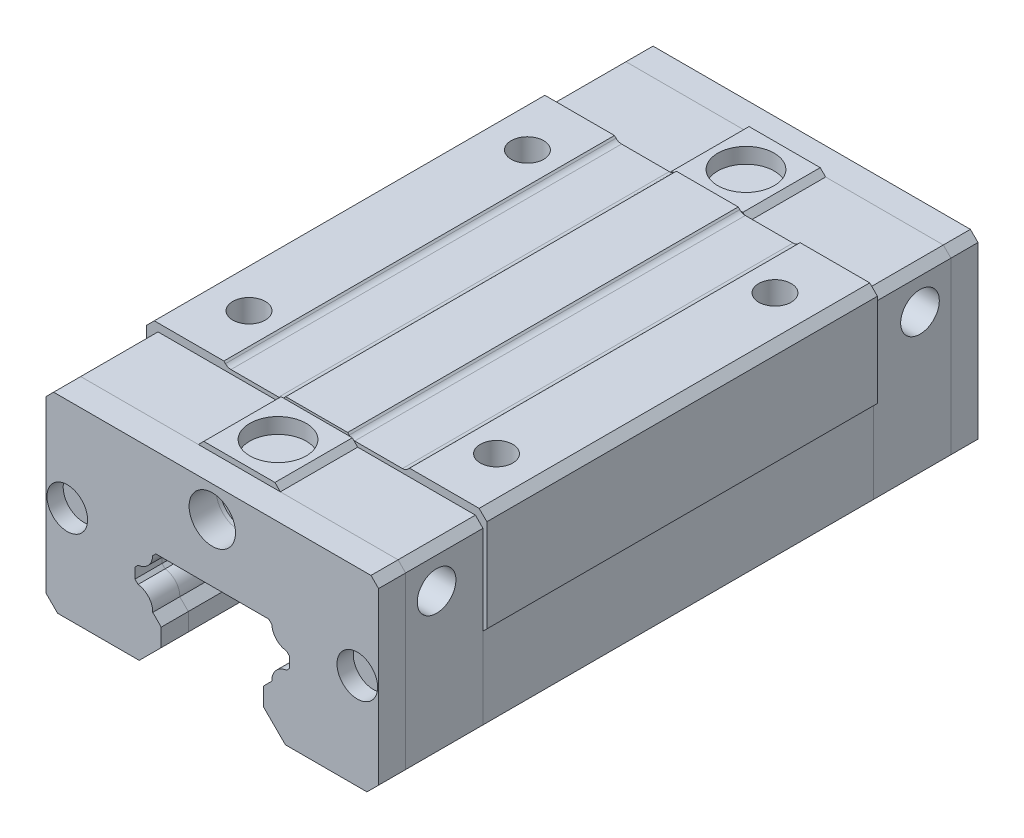
from build123d import *

# Parameters (mm, degrees)
BASE_DEPTH                     = 25.25
GREEN_BODY_DEPTH               = 10
SKETCH5_R                      = 3.65
TOP_HOLE_GB_DEPTH              = 2
SKETCH6_R                      = 2.5
SIDE_HOLE_GB_DEPTH             = 6.7
GREEN_BODY_VM_DEPTH            = 10
GB_FEATURES_VM_COPY_1_SKETCH_R = 2.5
GB_FEATURES_VM_COPY_1_DEPTH    = 6.7
RED_BODY_DEPTH                 = 3.5
SKETCH9_R                      = 2.625
RB_HOLE_DEPTH                  = 2.1
SKETCH10_R                     = 3
CUT_EXTRUDE1_DEPTH             = 4


with BuildPart() as part:
    # Sketch1 → BASE (new, symmetric)
    with BuildSketch(Plane.XY):
        with BuildLine():
            Line((-7.3, 3.5), (7.3, 3.5))
            Line((7.3, 3.5), (7.7, 3.1))
            ThreePointArc((7.7, 3.1), (8.274662952, 1.735331905), (9.6, 1.075))
            Line((9.6, 1.075), (10, 0.675))
            Line((10, 0.675), (10, -0.675))
            Line((10, -0.675), (9.6, -1.075))
            ThreePointArc((9.6, -1.075), (8.225097216, -1.791320556), (7.7, -3.25))
            Line((7.7, -3.25), (6.6, -4.35))
            Line((6.6, -4.35), (6.6, -6.65))
            Line((6.6, -6.65), (9.45, -9.5))
            Line((9.45, -9.5), (20, -9.5))
            Line((20, -9.5), (21.5, -8))
            Line((21.5, -8), (21.5, 2.5))
            Line((21.5, 2.5), (22, 3))
            Line((22, 3), (22, 15))
            Line((22, 15), (21, 16))
            Line((21, 16), (12, 16))
            Line((12, 16), (11.8, 15.8))
            ThreePointArc((11.8, 15.8), (11.473155492, 15.578045554), (11.085857157, 15.5))
            Line((11.085857157, 15.5), (4.914142843, 15.5))
            ThreePointArc((4.914142843, 15.5), (4.526844508, 15.578045554), (4.2, 15.8))
            Line((4.2, 15.8), (4, 16))
            Line((4, 16), (-4, 16))
            Line((-4, 16), (-4.2, 15.8))
            ThreePointArc((-4.2, 15.8), (-4.526844508, 15.578045554), (-4.914142843, 15.5))
            Line((-4.914142843, 15.5), (-11.085857157, 15.5))
            ThreePointArc((-11.085857157, 15.5), (-11.473155492, 15.578045554), (-11.8, 15.8))
            Line((-11.8, 15.8), (-12, 16))
            Line((-12, 16), (-21, 16))
            Line((-21, 16), (-22, 15))
            Line((-22, 15), (-22, 8))
            Line((-22, 8), (-21.5, 7.5))
            Line((-21.5, 7.5), (-21.5, -8))
            Line((-21.5, -8), (-20, -9.5))
            Line((-20, -9.5), (-9.45, -9.5))
            Line((-9.45, -9.5), (-6.6, -6.65))
            Line((-6.6, -6.65), (-6.6, -4.35))
            Line((-6.6, -4.35), (-7.7, -3.25))
            ThreePointArc((-7.7, -3.25), (-8.225097216, -1.791320556), (-9.6, -1.075))
            Line((-9.6, -1.075), (-10, -0.675))
            Line((-10, -0.675), (-10, 0.675))
            Line((-10, 0.675), (-9.6, 1.075))
            ThreePointArc((-9.6, 1.075), (-8.274662952, 1.735331905), (-7.7, 3.1))
            Line((-7.7, 3.1), (-7.3, 3.5))
        make_face()
    extrude(amount=BASE_DEPTH, both=True)

    # Sketch3 → M5x0.8 Tapped Hole1 (revolve, cut)
    with BuildSketch(Plane(origin=(-16, 16, -18), x_dir=(0, 0, 1), z_dir=(1, 0, 0))):
        Polygon((0, 0), (0, 7.2618073), (2.1, 6), (2.1, 0), align=None)
    m5x0_8_tapped_hole1 = revolve(axis=Axis((-16, 22.35, -18), (0, -1, 0)), mode=Mode.SUBTRACT)

    # HM: M5x0.8 Tapped Hole1 across plane
    add(m5x0_8_tapped_hole1.mirror(Plane(origin=(0, 0, 0), x_dir=(0, 0, 1), z_dir=(1, 0, 0))), mode=Mode.SUBTRACT)

    # VM: M5x0.8 Tapped Hole1 across plane
    add(m5x0_8_tapped_hole1.mirror(Plane.XY), mode=Mode.SUBTRACT)

    # VM copy 1 sketch → VM copy 1 (revolve, cut)
    with BuildSketch(Plane(origin=(16, 16, 18), x_dir=(0, 0, -1), z_dir=(-1, 0, 0))):
        Polygon((0, 0), (0, 7.2618073), (2.1, 6), (2.1, 0), align=None)
    revolve(axis=Axis((16, 22.35, 18), (0, -1, 0)), mode=Mode.SUBTRACT)


with BuildPart() as body_2:
    # Sketch4 → GREEN BODY (new body)
    with BuildSketch(Plane.XY.offset(25.25)):
        with BuildLine():
            Line((-21.5, 14.016514164), (-20.516514164, 15))
            Line((-20.516514164, 15), (-5.3, 15))
            Line((-5.3, 15), (-4.6, 15.7))
            Line((-4.6, 15.7), (4.6, 15.7))
            Line((4.6, 15.7), (5.3, 15))
            Line((5.3, 15), (20.516514164, 15))
            Line((20.516514164, 15), (21.5, 14.016514164))
            Line((21.5, 14.016514164), (21.5, -8))
            Line((21.5, -8), (20, -9.5))
            Line((20, -9.5), (9.45, -9.5))
            Line((9.45, -9.5), (6.6, -6.65))
            Line((6.6, -6.65), (6.6, -4.35))
            Line((6.6, -4.35), (7.7, -3.25))
            ThreePointArc((7.7, -3.25), (8.225097216, -1.791320556), (9.6, -1.075))
            Line((9.6, -1.075), (10, -0.675))
            Line((10, -0.675), (10, 0.675))
            Line((10, 0.675), (9.6, 1.075))
            ThreePointArc((9.6, 1.075), (8.274662952, 1.735331905), (7.7, 3.1))
            Line((7.7, 3.1), (7.3, 3.5))
            Line((7.3, 3.5), (-7.3, 3.5))
            Line((-7.3, 3.5), (-7.7, 3.1))
            ThreePointArc((-7.7, 3.1), (-8.274662952, 1.735331905), (-9.6, 1.075))
            Line((-9.6, 1.075), (-10, 0.675))
            Line((-10, 0.675), (-10, -0.675))
            Line((-10, -0.675), (-9.6, -1.075))
            ThreePointArc((-9.6, -1.075), (-8.225097216, -1.791320556), (-7.7, -3.25))
            Line((-7.7, -3.25), (-6.6, -4.35))
            Line((-6.6, -4.35), (-6.6, -6.65))
            Line((-6.6, -6.65), (-9.45, -9.5))
            Line((-9.45, -9.5), (-20, -9.5))
            Line((-20, -9.5), (-21.5, -8))
            Line((-21.5, -8), (-21.5, 14.016514164))
        make_face()
    extrude(amount=GREEN_BODY_DEPTH)

    # Sketch5 → TOP HOLE GB (cut)
    with BuildSketch(Plane(origin=(0, 15.7, 0), x_dir=(1, 0, 0), z_dir=(0, 1, 0))):
        with Locations(Location((0, -30.25, 0), (0, 0, 270))):
            Circle(SKETCH5_R)
    top_hole_gb = extrude(amount=-TOP_HOLE_GB_DEPTH, mode=Mode.SUBTRACT)

    # Sketch6 → SIDE HOLE GB (cut)
    with BuildSketch(Plane.ZY.offset(21.5)):
        with Locations((31.25, 10)):
            Circle(SKETCH6_R)
    side_hole_gb = extrude(amount=-SIDE_HOLE_GB_DEPTH, mode=Mode.SUBTRACT)

    # SHGB HM: SIDE HOLE GB across plane
    add(side_hole_gb.mirror(Plane(origin=(0, 0, 0), x_dir=(0, 0, 1), z_dir=(1, 0, 0))), mode=Mode.SUBTRACT)


with BuildPart() as body_3:
    # Sketch7 → GREEN BODY VM (new body)
    with BuildSketch(Plane(origin=(0, 0, -25.25), x_dir=(-1, 0, 0), z_dir=(0, 0, -1))):
        with BuildLine():
            Line((-20.516514164, 15), (-21.5, 14.016514164))
            Line((-21.5, 14.016514164), (-21.5, -8))
            Line((-21.5, -8), (-20, -9.5))
            Line((-20, -9.5), (-9.45, -9.5))
            Line((-9.45, -9.5), (-6.6, -6.65))
            Line((-6.6, -6.65), (-6.6, -4.35))
            Line((-6.6, -4.35), (-7.7, -3.25))
            ThreePointArc((-7.7, -3.25), (-8.225097216, -1.791320556), (-9.6, -1.075))
            Line((-9.6, -1.075), (-10, -0.675))
            Line((-10, -0.675), (-10, 0.675))
            Line((-10, 0.675), (-9.6, 1.075))
            ThreePointArc((-9.6, 1.075), (-8.274662952, 1.735331905), (-7.7, 3.1))
            Line((-7.7, 3.1), (-7.3, 3.5))
            Line((-7.3, 3.5), (7.3, 3.5))
            Line((7.3, 3.5), (7.7, 3.1))
            ThreePointArc((7.7, 3.1), (8.274662952, 1.735331905), (9.6, 1.075))
            Line((9.6, 1.075), (10, 0.675))
            Line((10, 0.675), (10, -0.675))
            Line((10, -0.675), (9.6, -1.075))
            ThreePointArc((9.6, -1.075), (8.225097216, -1.791320556), (7.7, -3.25))
            Line((7.7, -3.25), (6.6, -4.35))
            Line((6.6, -4.35), (6.6, -6.65))
            Line((6.6, -6.65), (9.45, -9.5))
            Line((9.45, -9.5), (20, -9.5))
            Line((20, -9.5), (21.5, -8))
            Line((21.5, -8), (21.5, 14.016514164))
            Line((21.5, 14.016514164), (20.516514164, 15))
            Line((20.516514164, 15), (5.3, 15))
            Line((5.3, 15), (4.6, 15.7))
            Line((4.6, 15.7), (-4.6, 15.7))
            Line((-4.6, 15.7), (-5.3, 15))
            Line((-5.3, 15), (-20.516514164, 15))
        make_face()
    extrude(amount=GREEN_BODY_VM_DEPTH)

    # GB FEATURES VM: TOP HOLE GB, SIDE HOLE GB across plane
    add(top_hole_gb.mirror(Plane.XY), mode=Mode.SUBTRACT)
    add(side_hole_gb.mirror(Plane.XY), mode=Mode.SUBTRACT)

    # GB FEATURES VM copy 1 sketch → GB FEATURES VM copy 1 (cut)
    with BuildSketch(Plane(origin=(21.5, 0, 0), x_dir=(0, 0, -1), z_dir=(1, 0, 0))):
        with Locations((31.25, 10)):
            Circle(GB_FEATURES_VM_COPY_1_SKETCH_R)
    extrude(amount=-GB_FEATURES_VM_COPY_1_DEPTH, mode=Mode.SUBTRACT)


with BuildPart() as body_4:
    # Sketch8 → RED BODY (new body)
    with BuildSketch(Plane.XY.offset(35.25)):
        with BuildLine():
            Line((-20.516514164, 15), (20.516514164, 15))
            Line((20.516514164, 15), (21.5, 14.016514164))
            Line((21.5, 14.016514164), (21.5, -8))
            Line((21.5, -8), (20, -9.5))
            Line((20, -9.5), (9.45, -9.5))
            Line((9.45, -9.5), (6.6, -6.65))
            Line((6.6, -6.65), (6.6, -4.35))
            Line((6.6, -4.35), (7.7, -3.25))
            ThreePointArc((7.7, -3.25), (8.225097216, -1.791320556), (9.6, -1.075))
            Line((9.6, -1.075), (10, -0.675))
            Line((10, -0.675), (10, 0.675))
            Line((10, 0.675), (9.6, 1.075))
            ThreePointArc((9.6, 1.075), (8.274662952, 1.735331905), (7.7, 3.1))
            Line((7.7, 3.1), (7.3, 3.5))
            Line((7.3, 3.5), (-7.3, 3.5))
            Line((-7.3, 3.5), (-7.7, 3.1))
            ThreePointArc((-7.7, 3.1), (-8.274662952, 1.735331905), (-9.6, 1.075))
            Line((-9.6, 1.075), (-10, 0.675))
            Line((-10, 0.675), (-10, -0.675))
            Line((-10, -0.675), (-9.6, -1.075))
            ThreePointArc((-9.6, -1.075), (-8.225097216, -1.791320556), (-7.7, -3.25))
            Line((-7.7, -3.25), (-6.6, -4.35))
            Line((-6.6, -4.35), (-6.6, -6.65))
            Line((-6.6, -6.65), (-9.45, -9.5))
            Line((-9.45, -9.5), (-20, -9.5))
            Line((-20, -9.5), (-21.5, -8))
            Line((-21.5, -8), (-21.5, 14.016514164))
            Line((-21.5, 14.016514164), (-20.516514164, 15))
        make_face()
    extrude(amount=RED_BODY_DEPTH)

    # Sketch9 → RB HOLE (cut)
    with BuildSketch(Plane.XY.offset(38.75)):
        with Locations((-18.75, 2.9)):
            Circle(SKETCH9_R)
    rb_hole = extrude(amount=-RB_HOLE_DEPTH, mode=Mode.SUBTRACT)

    # RBH HM: RB HOLE across plane
    add(rb_hole.mirror(Plane(origin=(0, 0, 0), x_dir=(0, 0, 1), z_dir=(1, 0, 0))), mode=Mode.SUBTRACT)


with BuildPart() as body_5:
    # RB AND HOLES VM: mirrored copy
    add(body_4.part.mirror(Plane.XY))


with BuildPart() as cut_extrude1_tool:
    # Sketch10 → Cut-Extrude1 (new body)
    with BuildSketch(Plane.XY.offset(38.75)):
        with Locations((0, 11)):
            Circle(SKETCH10_R)
    extrude(amount=-CUT_EXTRUDE1_DEPTH)


with BuildPart() as body_2_1:
    add(body_2.part)

    # Cut-Extrude1: cut by cut_extrude1_tool
    add(cut_extrude1_tool.part, mode=Mode.SUBTRACT)


with BuildPart() as body_4_1:
    add(body_4.part)

    # Cut-Extrude1: cut by cut_extrude1_tool
    add(cut_extrude1_tool.part, mode=Mode.SUBTRACT)


solid = Compound([part.part, body_3.part, body_5.part, body_2_1.part, body_4_1.part])
